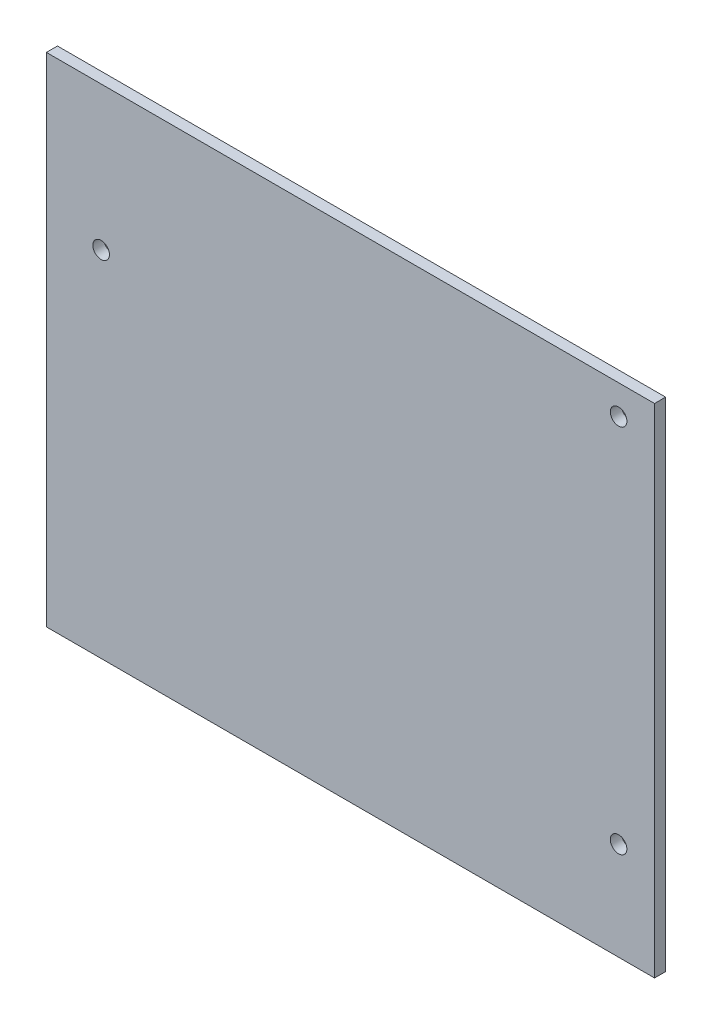
from build123d import *

# Parameters (mm, degrees)
ESQUISSE1_W        = 110
ESQUISSE1_H        = 90
ESQUISSE1_R        = 1.5
BOSS_EXTRU_1_DEPTH = 2


with BuildPart() as part:
    # Esquisse1 → Boss.-Extru.1 (new body)
    with BuildSketch(Plane.XY):
        Rectangle(ESQUISSE1_W, ESQUISSE1_H)
        with Locations((48.5, 39.7)):
            Circle(ESQUISSE1_R, mode=Mode.SUBTRACT)
        with Locations((-45.1, 19)):
            Circle(ESQUISSE1_R, mode=Mode.SUBTRACT)
        with Locations((48.5, -27.3)):
            Circle(ESQUISSE1_R, mode=Mode.SUBTRACT)
    extrude(amount=BOSS_EXTRU_1_DEPTH)


solid = part.part
